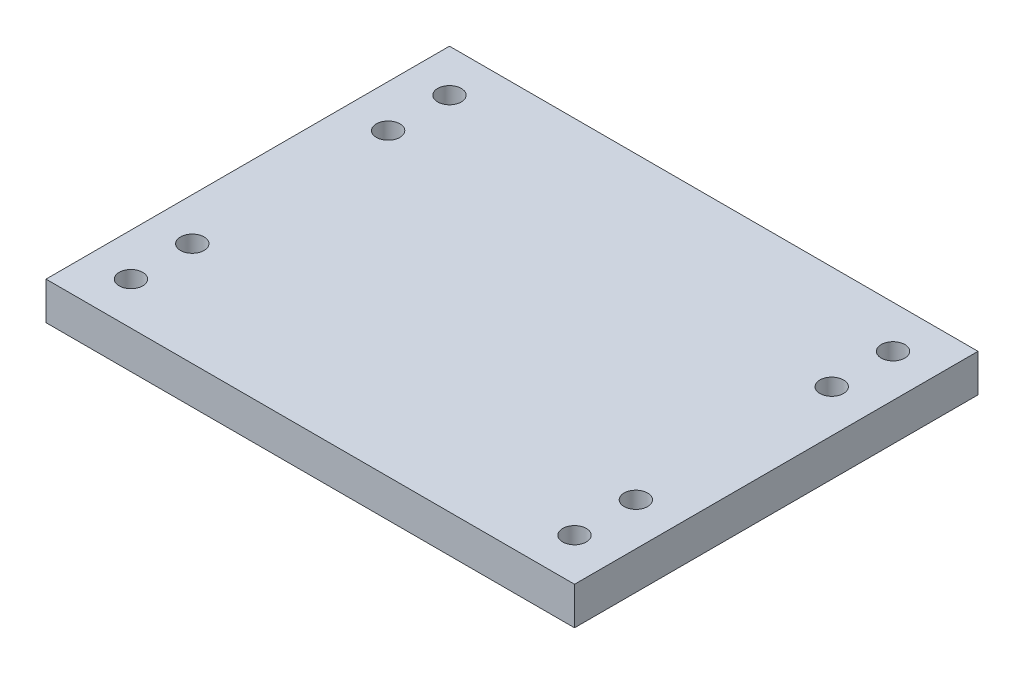
from build123d import *

# Parameters (mm, degrees)
SKETCH1_W                       = 22.4
SKETCH1_H                       = 17.1
MAIN_BODY_DEPTH                 = 1.6
SKETCH2_R                       = 0.5
SOLDERED_CONNECTION_HOLES_DEPTH = 15.181061314
MIRROR2_COPY_1_SKETCH_R         = 0.5
MIRROR2_COPY_1_DEPTH            = 15.181061314


with BuildPart() as part:
    # Sketch1 → MAIN BODY (new body)
    with BuildSketch(Plane(origin=(0, 0, 0), x_dir=(1, 0, 0), z_dir=(0, 1, 0))):
        Rectangle(SKETCH1_W, SKETCH1_H)
    extrude(amount=MAIN_BODY_DEPTH)

    # Sketch2 → SOLDERED CONNECTION HOLES (cut, through all)
    with BuildSketch(Plane(origin=(0, 1.6, 0), x_dir=(1, 0, 0), z_dir=(0, 1, 0))):
        with Locations(Location((-9.4, 6.75, 0), (0, 0, 270))):
            Circle(SKETCH2_R)
        with Locations(Location((-9.4, 4.15, 0), (0, 0, 270))):
            Circle(SKETCH2_R)
    soldered_connection_holes = extrude(amount=-SOLDERED_CONNECTION_HOLES_DEPTH, mode=Mode.SUBTRACT)

    # Mirror1: SOLDERED CONNECTION HOLES across plane
    add(soldered_connection_holes.mirror(Plane(origin=(0, 0, 0), x_dir=(0, 0, 1), z_dir=(1, 0, 0))), mode=Mode.SUBTRACT)

    # Mirror2: SOLDERED CONNECTION HOLES across plane
    add(soldered_connection_holes.mirror(Plane.XY), mode=Mode.SUBTRACT)

    # Mirror2 copy 1 sketch → Mirror2 copy 1 (cut, through all)
    with BuildSketch(Plane(origin=(0, 1.6, 0), x_dir=(-1, 0, 0), z_dir=(0, 1, 0))):
        with Locations(Location((-9.4, 6.75, 0), (0, 0, 270))):
            Circle(MIRROR2_COPY_1_SKETCH_R)
        with Locations(Location((-9.4, 4.15, 0), (0, 0, 270))):
            Circle(MIRROR2_COPY_1_SKETCH_R)
    extrude(amount=-MIRROR2_COPY_1_DEPTH, mode=Mode.SUBTRACT)


solid = part.part
